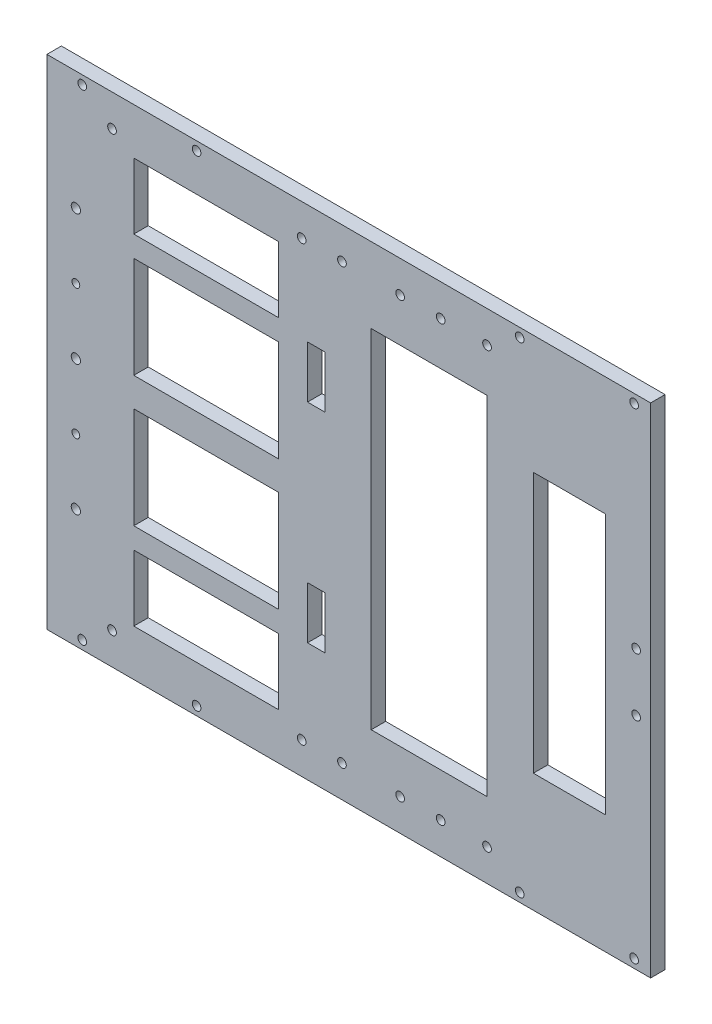
from build123d import *

# Parameters (mm, degrees)
SKETCH_1_W          = 50
SKETCH_1_H          = 22.75
SKETCH_1_H_2        = 35
SKETCH_1_W_2        = 40
SKETCH_1_H_3        = 120
SKETCH_1_W_3        = 25
SKETCH_1_H_4        = 90
SKETCH_1_W_4        = 6
SKETCH_1_H_5        = 18
EXTRUDE_1_DEPTH     = 5
SKETCH_2_R          = 1.5
CUT_EXTRUDE_1_DEPTH = 10
SKETCH_3_R          = 1.5
CUT_EXTRUDE_2_DEPTH = 10
SKETCH_4_R          = 1.5
CUT_EXTRUDE_3_DEPTH = 10
SKETCH_5_R          = 1.5
CUT_EXTRUDE_4_DEPTH = 24
SKETCH_6_R          = 1.6
CUT_EXTRUDE_5_DEPTH = 10
SKETCH_7_W          = 3
SKETCH_7_H          = 172
CUT_EXTRUDE_6_DEPTH = 10
SKETCH_9_R          = 1.5
CUT_EXTRUDE_7_DEPTH = 5
SKETCH_10_R         = 1.35
CUT_EXTRUDE_8_DEPTH = 10


with BuildPart() as part:
    # 草图1 → 凸台-拉伸1 (new body)
    with BuildSketch(Plane.XY):
        Polygon((-105.75, 86), (-105.75, 70), (-105.75, -86), (105.75, -86), (105.75, 86), align=None)
        with Locations((-50.75, 58.625)):
            Rectangle(SKETCH_1_W, SKETCH_1_H, mode=Mode.SUBTRACT)
        with Locations((-50.75, 22.5)):
            Rectangle(SKETCH_1_W, SKETCH_1_H_2, mode=Mode.SUBTRACT)
        with Locations((-50.75, -58.625)):
            Rectangle(SKETCH_1_W, SKETCH_1_H, mode=Mode.SUBTRACT)
        with Locations((26.25, 0)):
            Rectangle(SKETCH_1_W_2, SKETCH_1_H_3, mode=Mode.SUBTRACT)
        with Locations((74.75, 0)):
            Rectangle(SKETCH_1_W_3, SKETCH_1_H_4, mode=Mode.SUBTRACT)
        with Locations((-50.75, -22.5)):
            Rectangle(SKETCH_1_W, SKETCH_1_H_2, mode=Mode.SUBTRACT)
        with Locations((-12.75, -36)):
            Rectangle(SKETCH_1_W_4, SKETCH_1_H_5, mode=Mode.SUBTRACT)
        with Locations((-12.75, 36)):
            Rectangle(SKETCH_1_W_4, SKETCH_1_H_5, mode=Mode.SUBTRACT)
    extrude(amount=EXTRUDE_1_DEPTH)

    # 草图2 → 切除-拉伸1 (cut)
    with BuildSketch(Plane.XY.offset(5)):
        with Locations((97.05, 83)):
            Circle(SKETCH_2_R)
        with Locations((-93.55, 83)):
            Circle(SKETCH_2_R)
        with Locations((57.55, 83)):
            Circle(SKETCH_2_R)
        with Locations((-54.05, 83)):
            Circle(SKETCH_2_R)
        with Locations((57.55, -83)):
            Circle(SKETCH_2_R)
        with Locations((97.05, -83)):
            Circle(SKETCH_2_R)
        with Locations((-54.05, -83)):
            Circle(SKETCH_2_R)
        with Locations((-93.55, -83)):
            Circle(SKETCH_2_R)
    extrude(amount=-CUT_EXTRUDE_1_DEPTH, mode=Mode.SUBTRACT)

    # 草图3 → 切除-拉伸2 (cut)
    with BuildSketch(Plane.XY.offset(5)):
        with Locations((46.25, 75)):
            Circle(SKETCH_3_R)
        with Locations((46.25, -75)):
            Circle(SKETCH_3_R)
        with Locations((30.25, -75)):
            Circle(SKETCH_3_R)
        with Locations((30.25, 75)):
            Circle(SKETCH_3_R)
        with Locations((16.25, 75)):
            Circle(SKETCH_3_R)
        with Locations((16.25, -75)):
            Circle(SKETCH_3_R)
    extrude(amount=-CUT_EXTRUDE_2_DEPTH, mode=Mode.SUBTRACT)

    # 草图4 → 切除-拉伸3 (cut)
    with BuildSketch(Plane.XY.offset(5)):
        with Locations((-3.85, 75)):
            Circle(SKETCH_4_R)
        with Locations((-3.85, -75)):
            Circle(SKETCH_4_R)
    extrude(amount=-CUT_EXTRUDE_3_DEPTH, mode=Mode.SUBTRACT)

    # 草图5 → 切除-拉伸4 (cut)
    with BuildSketch(Plane.XY.offset(5)):
        with Locations((-17.75, 75)):
            Circle(SKETCH_5_R)
        with Locations((-83.25, 75)):
            Circle(SKETCH_5_R)
        with Locations((-83.25, -75)):
            Circle(SKETCH_5_R)
        with Locations((-17.75, -75)):
            Circle(SKETCH_5_R)
    extrude(amount=-CUT_EXTRUDE_4_DEPTH, mode=Mode.SUBTRACT)

    # 草图6 → 切除-拉伸5 (cut)
    with BuildSketch(Plane.XY.offset(5)):
        with Locations((-95.75, 45)):
            Circle(SKETCH_6_R)
        with Locations((-95.75, 0)):
            Circle(SKETCH_6_R)
        with Locations((-95.75, -45)):
            Circle(SKETCH_6_R)
    extrude(amount=-CUT_EXTRUDE_5_DEPTH, mode=Mode.SUBTRACT)

    # 草图7 → 切除-拉伸6 (cut)
    with BuildSketch(Plane.XY.offset(5)):
        with Locations((104.25, 0)):
            Rectangle(SKETCH_7_W, SKETCH_7_H)
    extrude(amount=-CUT_EXTRUDE_6_DEPTH, mode=Mode.SUBTRACT)

    # 草图9 → 切除-拉伸7 (cut)
    with BuildSketch(Plane.XY.offset(5)):
        with Locations((97.75, 10)):
            Circle(SKETCH_9_R)
    cut_extrude_7 = extrude(amount=-CUT_EXTRUDE_7_DEPTH, mode=Mode.SUBTRACT)

    # 镜向1: 切除-拉伸7 across plane
    add(cut_extrude_7.mirror(Plane.ZX), mode=Mode.SUBTRACT)

    # 草图10 → 切除-拉伸8 (cut)
    with BuildSketch(Plane.XY.offset(5)):
        with Locations((-95.75, 22.5)):
            Circle(SKETCH_10_R)
        with Locations((-95.75, -22.5)):
            Circle(SKETCH_10_R)
    extrude(amount=-CUT_EXTRUDE_8_DEPTH, mode=Mode.SUBTRACT)


solid = part.part
